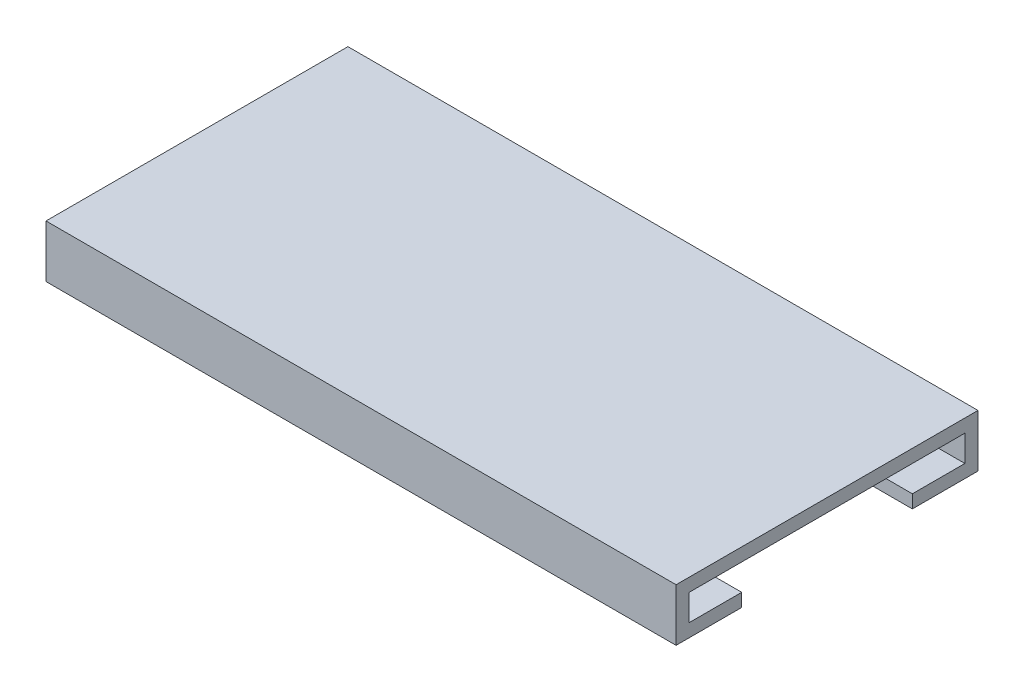
from build123d import *

# Parameters (mm, degrees)
BOSS_EXTRUDE1_DEPTH = 76.2


with BuildPart() as part:
    # Sketch1 → Boss-Extrude1 (new body)
    with BuildSketch(Plane(origin=(0, 0, 0), x_dir=(0, 0, -1), z_dir=(1, 0, 0))):
        Polygon((10.31875, -3.175), (18.25625, -3.175), (18.25625, 3.175), (-18.25625, 3.175), (-18.25625, -3.175), (-10.31875, -3.175), (-10.31875, -1.5875), (-16.66875, -1.5875), (-16.66875, 1.5875), (16.66875, 1.5875), (16.66875, -1.5875), (10.31875, -1.5875), align=None)
    extrude(amount=BOSS_EXTRUDE1_DEPTH)


solid = part.part
